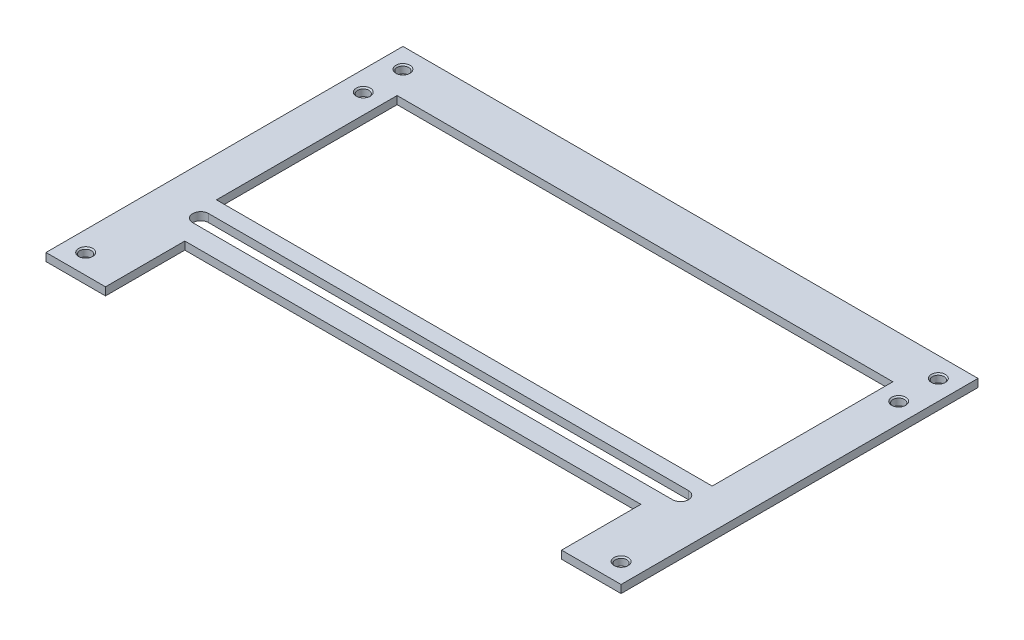
from build123d import *

# Parameters (mm, degrees)
EXTRUDE_1_DEPTH                = 2
HOLE_WIZARD_M3_5_2_D           = 2.9
HOLE_WIZARD_M3_5_2_CSINK_D     = 3.55
HOLE_WIZARD_M3_5_2_CSINK_ANGLE = 90
CUT_EXTRUDE_1_DEPTH            = 3
SKETCH_7_W                     = 125
SKETCH_7_H                     = 45.551843708
CUT_EXTRUDE_2_DEPTH            = 3


with BuildPart() as part:
    # 草图1 → 凸台-拉伸1 (new body)
    with BuildSketch(Plane(origin=(0, 0, 0), x_dir=(1, 0, 0), z_dir=(0, 1, 0))):
        Polygon((0, 0), (0, -10), (15, -10), (15, 0), (15, 10), (130, 10), (130, 0), (130, -10), (145, -10), (145, 0), (145, 80), (0, 80), align=None)
    extrude(amount=EXTRUDE_1_DEPTH)

    # M3.5 螺纹孔2 (through all)
    with Locations(Plane(origin=(0, 2, 0), x_dir=(1, 0, 0), z_dir=(0, 1, 0))):
        with Locations((5, 65), (5, 75), (140, 75), (140, -5), (5, -5), (140, 65)):
            CounterSinkHole(HOLE_WIZARD_M3_5_2_D / 2, HOLE_WIZARD_M3_5_2_CSINK_D / 2, counter_sink_angle=HOLE_WIZARD_M3_5_2_CSINK_ANGLE)

    # 草图6 → 切除-拉伸1 (cut)
    with BuildSketch(Plane(origin=(0, 2, 0), x_dir=(1, 0, 0), z_dir=(0, 1, 0))):
        with BuildLine():
            Line((12, 19), (133, 19))
            ThreePointArc((133, 19), (135, 17), (133, 15))
            Line((133, 15), (12, 15))
            ThreePointArc((12, 15), (10, 17), (12, 19))
        make_face()
    extrude(amount=-CUT_EXTRUDE_1_DEPTH, mode=Mode.SUBTRACT)

    # 草图7 → 切除-拉伸2 (cut)
    with BuildSketch(Plane(origin=(0, 2, 0), x_dir=(1, 0, 0), z_dir=(0, 1, 0))):
        with Locations((72.5, 45.7539171)):
            Rectangle(SKETCH_7_W, SKETCH_7_H)
    extrude(amount=-CUT_EXTRUDE_2_DEPTH, mode=Mode.SUBTRACT)


solid = part.part
